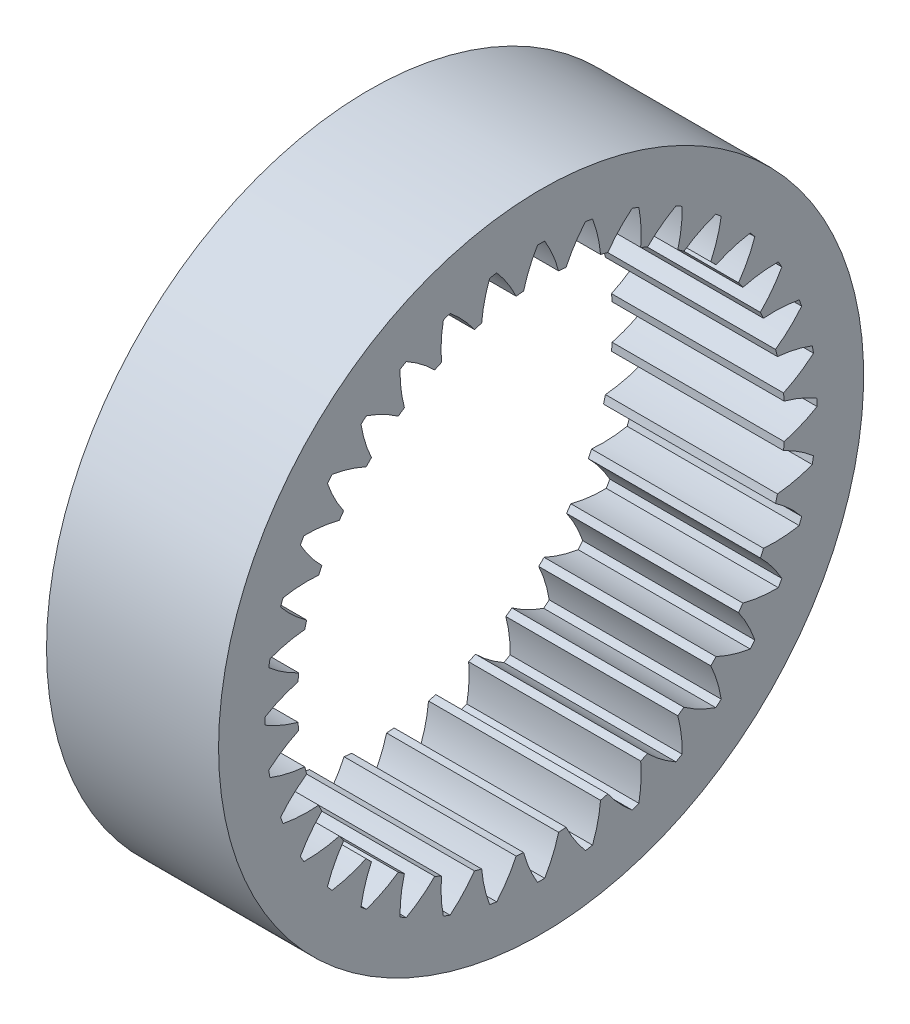
from build123d import *

# Parameters (mm, degrees)
BASPROSKE_W     = 12
BASPROSKE_H     = 5.5
TOOTHCUT_DEPTH  = 35.007352146
TEETHCUTS_COUNT = 36
TEETHCUTS_ANGLE = 350


with BuildPart() as part:
    # BasProSke → Base-Revolve (revolve)
    with BuildSketch(Plane(origin=(0, 0, 0), x_dir=(1, 0, 0), z_dir=(0, 1, 0)), mode=Mode.PRIVATE) as base_revolve_sk:
        with Locations((6, 19.75)):
            Rectangle(BASPROSKE_W, BASPROSKE_H)
    revolve(base_revolve_sk.sketch.rotate(Axis((-10, 0, 0), (1, 0, 0)), 180), axis=Axis((-10, 0, 0), (1, 0, 0)))

    # TooCutSke → ToothCut (cut, through all)
    with BuildSketch(Plane(origin=(0, 0, 0), x_dir=(0, 0, -1), z_dir=(1, 0, 0))):
        with BuildLine():
            ThreePointArc((1.227709503, 16.930143961), (0.820232188, 18.124115958), (0.249802933, 19.249379198))
            ThreePointArc((0.249802933, 19.249379198), (0, 19.251), (-0.249802933, 19.249379198))
            ThreePointArc((-0.249802933, 19.249379198), (-0.820232188, 18.124115958), (-1.227709503, 16.930143961))
            ThreePointArc((-1.227709503, 16.930143961), (0, 16.9746), (1.227709503, 16.930143961))
        make_face()
    toothcut = extrude(amount=TOOTHCUT_DEPTH, mode=Mode.SUBTRACT)

    # TeethCuts: ToothCut ×36 about axis
    teethcuts_axis = Axis((-10, 0, 0), (1, 0, 0))
    for i in range(1, TEETHCUTS_COUNT):
        add(toothcut.rotate(teethcuts_axis, i * TEETHCUTS_ANGLE / (TEETHCUTS_COUNT - 1)), mode=Mode.SUBTRACT)


solid = part.part
